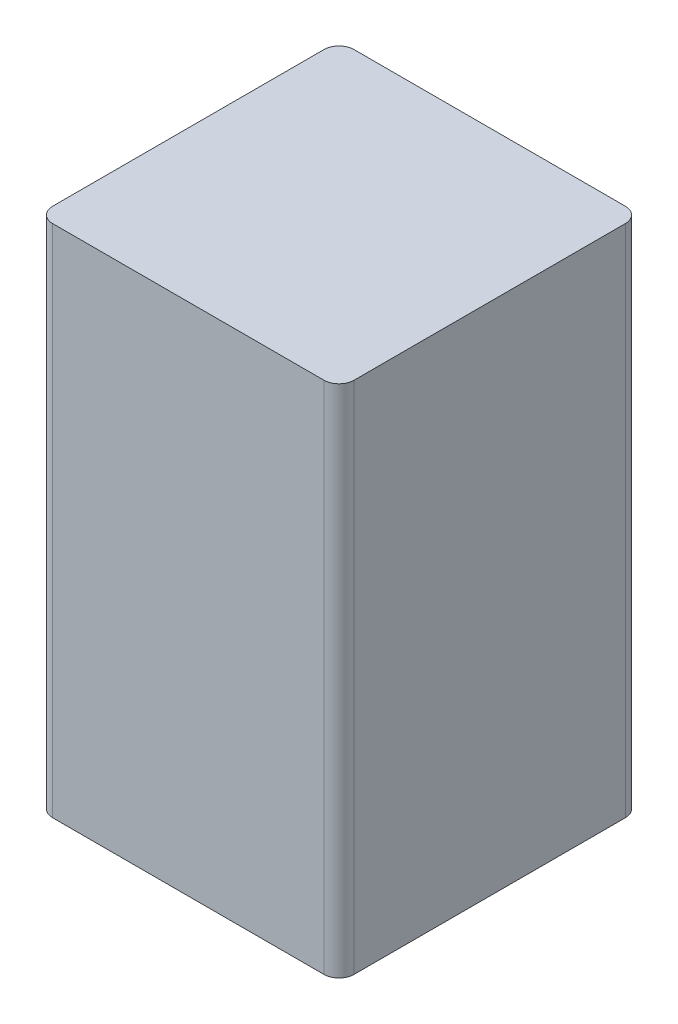
from build123d import *

# Parameters (mm, degrees)
SKETCH_1_W         = 40
SKETCH_1_H         = 68.3
BLOCKEXTRUDE_DEPTH = 40
FILLET_2_R         = 2


with BuildPart() as part:
    # 草图1 → BlockExtrude (new body)
    with BuildSketch(Plane.XY):
        with Locations((20, 34.15)):
            Rectangle(SKETCH_1_W, SKETCH_1_H)
    extrude(amount=BLOCKEXTRUDE_DEPTH)

    # Fillet 2
    fillet_2_edges = [part.edges().sort_by_distance(p)[0] for p in [
        (40, 34.15, 40),
        (0, 34.15, 40),
        (40, 34.15, 0),
        (0, 34.15, 0),
    ]]
    fillet(fillet_2_edges, radius=FILLET_2_R)


solid = part.part
